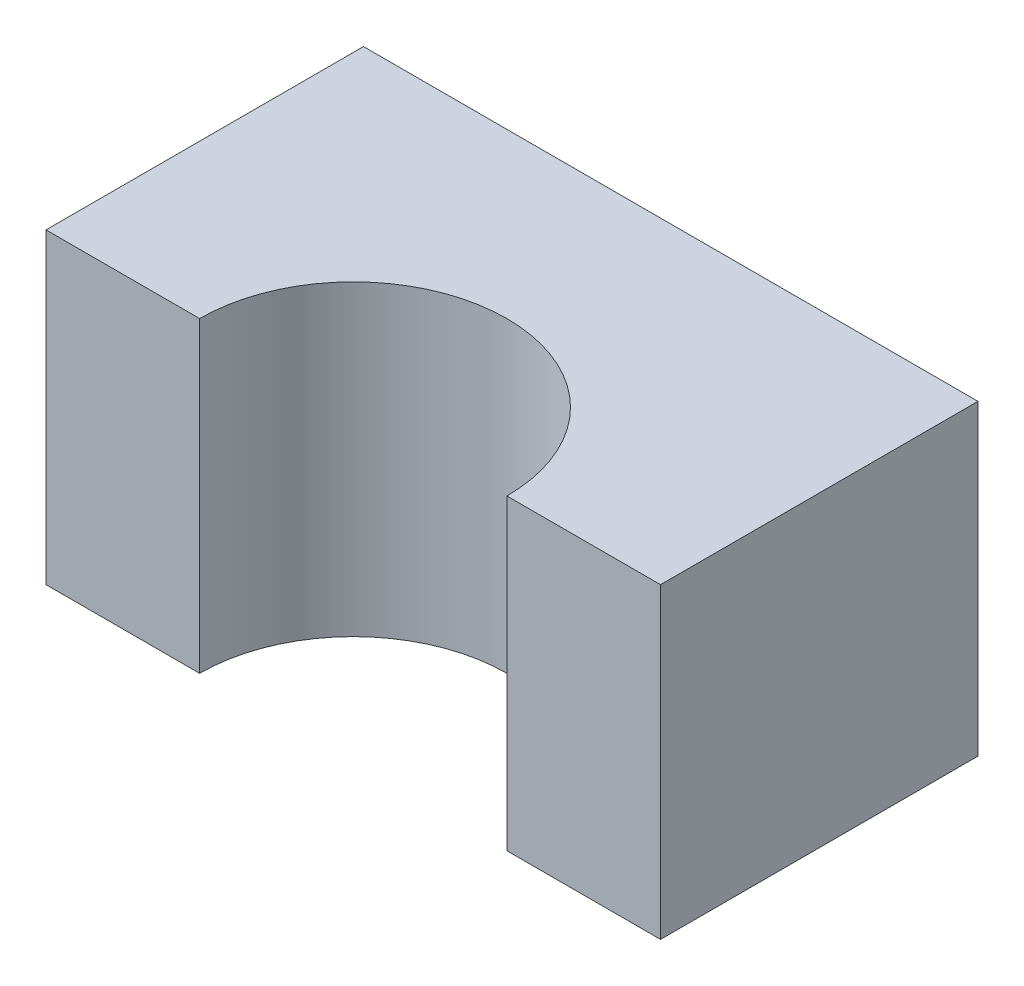
from build123d import *

# Parameters (mm, degrees)
SKETCH1_W           = 6
SKETCH1_H           = 3
BOSS_EXTRUDE1_DEPTH = 3.1
SKETCH2_R           = 1.5
CUT_EXTRUDE1_DEPTH  = 9


with BuildPart() as part:
    # Sketch1 → Boss-Extrude1 (new body)
    with BuildSketch(Plane.XY):
        with Locations((-22.107679988, 22.516041728)):
            Rectangle(SKETCH1_W, SKETCH1_H)
    extrude(amount=BOSS_EXTRUDE1_DEPTH)

    # Sketch2 → Cut-Extrude1 (cut)
    with BuildSketch(Plane(origin=(0, 24.016041728, 0), x_dir=(1, 0, 0), z_dir=(0, 1, 0))):
        with Locations((-22.107679988, -3.1)):
            Circle(SKETCH2_R)
    extrude(amount=-CUT_EXTRUDE1_DEPTH, mode=Mode.SUBTRACT)


solid = part.part
